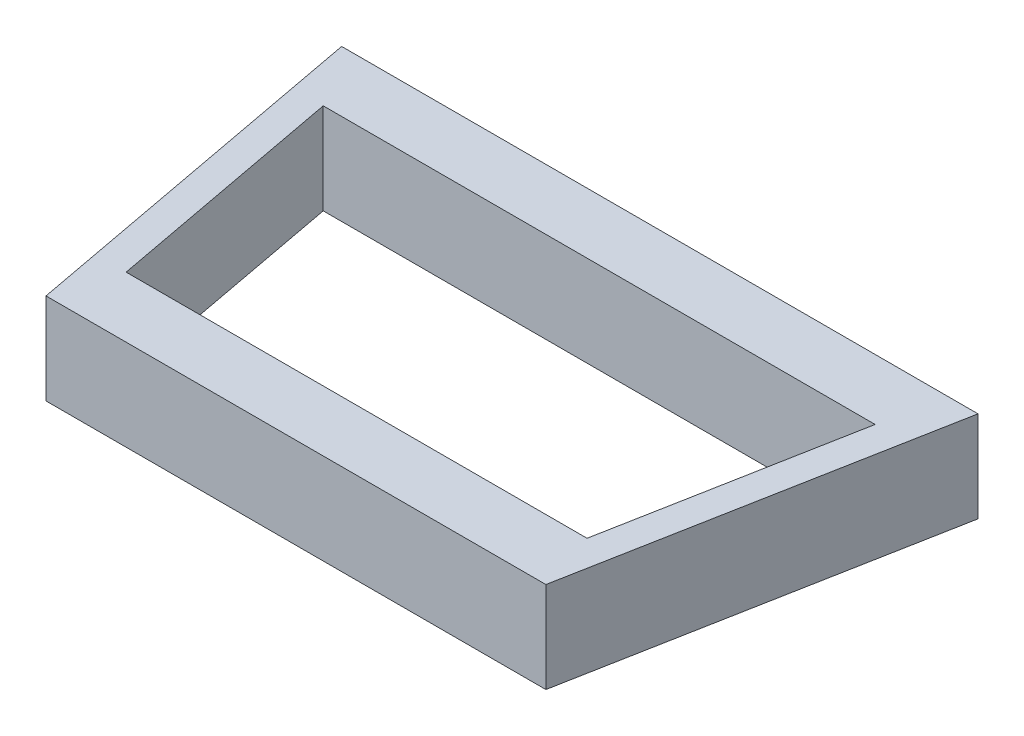
from build123d import *

# Parameters (mm, degrees)
BOSS_EXTRUDE1_DEPTH = 10
BOSS_EXTRUDE2_DEPTH = 1
SKETCH3_W           = 10
SKETCH3_H           = 3
BOSS_EXTRUDE3_DEPTH = 3
FILLET1_R           = 1


with BuildPart() as part:
    # Sketch1 → Boss-Extrude1 (new body)
    with BuildSketch(Plane(origin=(0, 0, 0), x_dir=(1, 0, 0), z_dir=(0, 1, 0))):
        Polygon((-10.492426287, 6), (10.492426287, 6), (8.242426287, -6), (-8.242426287, -6), align=None)
        Polygon((-9.1, 4), (9.1, 4), (7.6, -4), (-7.6, -4), align=None, mode=Mode.SUBTRACT)
    extrude(amount=BOSS_EXTRUDE1_DEPTH)

    # Sketch2 → Boss-Extrude2 (add)
    with BuildSketch(Plane(origin=(0, 10, 0), x_dir=(1, 0, 0), z_dir=(0, 1, 0))):
        Polygon((-10.492426287, 6), (-8.242426287, -6), (8.242426287, -6), (10.492426287, 6), align=None)
    extrude(amount=BOSS_EXTRUDE2_DEPTH)

    # Sketch3 → Boss-Extrude3 (add)
    with BuildSketch(Plane(origin=(0, 11, 0), x_dir=(1, 0, 0), z_dir=(0, 1, 0))):
        with Locations((0, 7.5)):
            Rectangle(SKETCH3_W, SKETCH3_H)
        with Locations((0, -7.5)):
            Rectangle(SKETCH3_W, SKETCH3_H)
    extrude(amount=-BOSS_EXTRUDE3_DEPTH)

    # Fillet1
    fillet1_edges = [part.edges().sort_by_distance(p)[0] for p in [
        (-5, 9.5, 9),
        (-5, 8, 7.5),
        (5, 8, 7.5),
        (5, 9.5, 9),
        (5, 9.5, -9),
        (5, 8, -7.5),
        (-5, 8, -7.5),
        (-5, 9.5, -9),
        (0, 8, -9),
        (0, 8, 9),
        (-5, 9.5, 6),
        (5, 9.5, 6),
        (0, 8, 6),
        (5, 9.5, -6),
        (-5, 9.5, -6),
        (0, 8, -6),
    ]]
    fillet(fillet1_edges, radius=FILLET1_R)

    # Split1
    split(bisect_by=Plane(origin=(0, 3, 0), x_dir=(0, 0, -1), z_dir=(0, -1, 0)), keep=Keep.TOP)


solid = part.part
